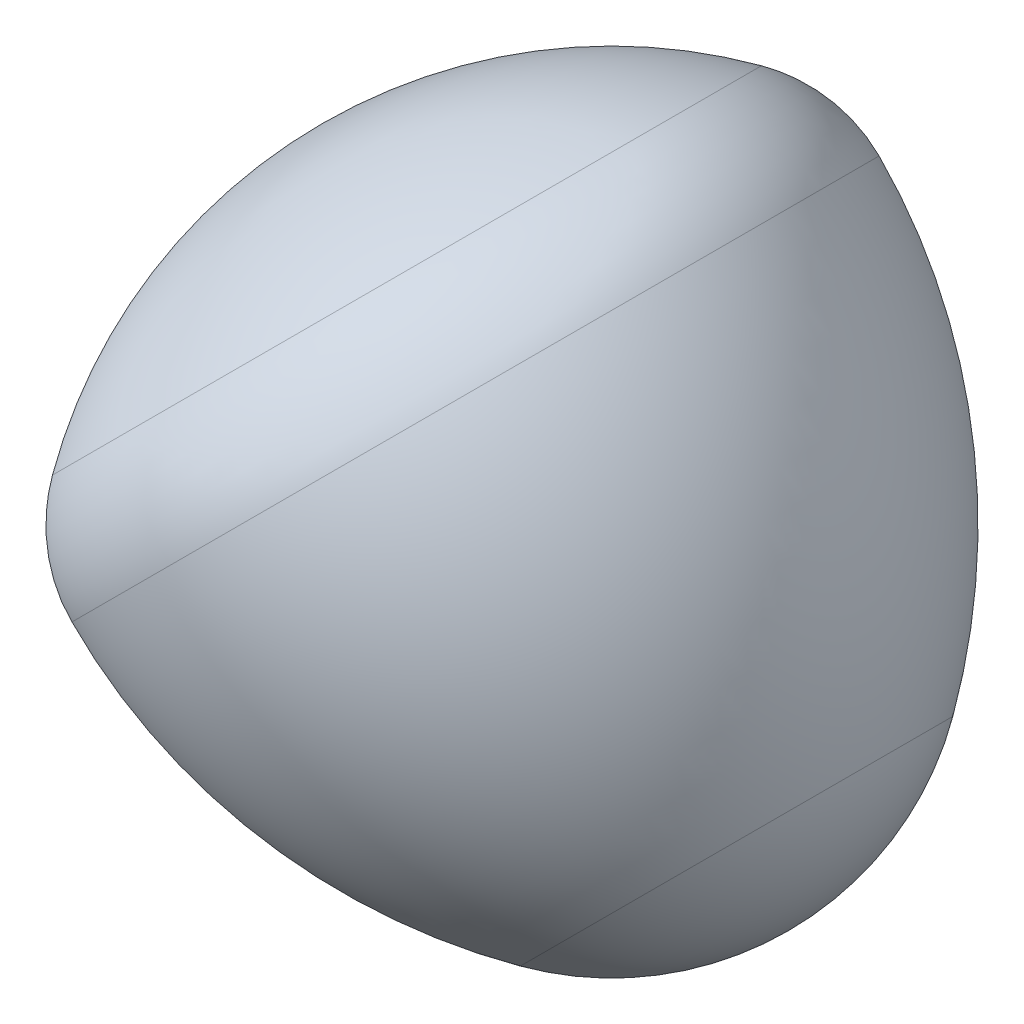
from build123d import *

# Parameters (mm, degrees)
SCALE1_SCALE = 0.5


with BuildPart() as part:
    # Sketch1 → Revolve1 (revolve)
    with BuildSketch(Plane.XY, mode=Mode.PRIVATE) as revolve1_sk:
        with BuildLine():
            Line((-21.957240737, 21.957240737), (13.398098322, -13.398098322))
            ThreePointArc((13.398098322, -13.398098322), (17.505459067, -7.250998561), (18.947772357, 0))
            ThreePointArc((18.947772357, 0), (15.93253635, 15.158615055), (7.345870679, 28.00946838))
            ThreePointArc((7.345870679, 28.00946838), (3.975556564, 30.261440275), (0, 31.052227643))
            ThreePointArc((0, 31.052227643), (-11.883173057, 28.688517558), (-21.957240737, 21.957240737))
        make_face()
    revolve(revolve1_sk.sketch.rotate(Axis((-52.286515691, 52.286515691, 0), (0.7071067811865465, -0.7071067811865487, 0)), 180), axis=Axis((-52.286515691, 52.286515691, 0), (0.7071067811865465, -0.7071067811865487, 0)))


with BuildPart() as part_1:
    # Scale1: scaled about (-5.771797202, 5.771797202, 0)
    add(part.part.scale(SCALE1_SCALE).moved(Location((-2.885898601, 2.885898601, 0))))


solid = part_1.part
